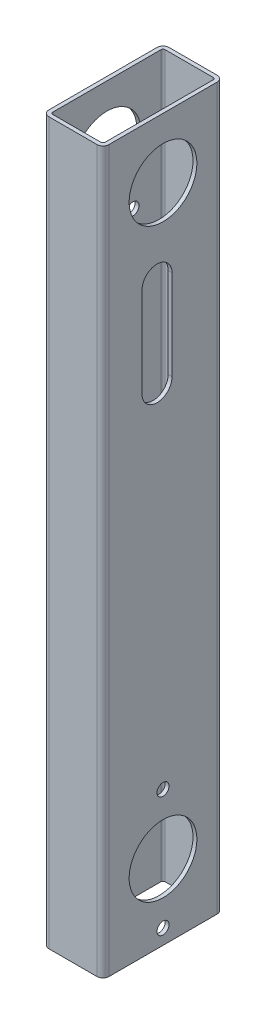
from build123d import *

# Parameters (mm, degrees)
EXTRUDE_THIN1_DEPTH      = 222.25
EXTRUDE_THIN1_DEPTH_BACK = 82.55
CUT_EXTRUDE1_REACH       = 227.134
CUT_EXTRUDE4_REACH       = 227.134
SKETCH4_R                = 2.5527
CUT_EXTRUDE3_DEPTH       = 1.651
SKETCH6_R                = 14.3256
CUT_EXTRUDE5_DEPTH       = 226.134143346
F_10_CLEARANCE_HOLE1_D   = 5.1054


with BuildPart() as part:
    # Sketch1 → Extrude-Thin1 (new, two sides: drawn at the far end of the back side and taken through both)
    with BuildSketch(Plane(origin=(0, 0, 0), x_dir=(1, 0, 0), z_dir=(0, 1, 0)).offset(-EXTRUDE_THIN1_DEPTH_BACK)):
        with BuildLine():
            Line((-10.16, 25.4), (10.16, 25.4))
            ThreePointArc((10.16, 25.4), (11.956051224, 24.656051224), (12.7, 22.86))
            Line((12.7, 22.86), (12.7, -22.86))
            ThreePointArc((12.7, -22.86), (11.956051224, -24.656051224), (10.16, -25.4))
            Line((10.16, -25.4), (-10.16, -25.4))
            ThreePointArc((-10.16, -25.4), (-11.956051224, -24.656051224), (-12.7, -22.86))
            Line((-12.7, -22.86), (-12.7, 22.86))
            ThreePointArc((-12.7, 22.86), (-11.956051224, 24.656051224), (-10.16, 25.4))
        make_face()
        with BuildLine():
            Line((-10.16, 23.749), (10.16, 23.749))
            ThreePointArc((10.16, 23.749), (10.788617928, 23.488617928), (11.049, 22.86))
            Line((11.049, 22.86), (11.049, -22.86))
            ThreePointArc((11.049, -22.86), (10.788617928, -23.488617928), (10.16, -23.749))
            Line((10.16, -23.749), (-10.16, -23.749))
            ThreePointArc((-10.16, -23.749), (-10.788617928, -23.488617928), (-11.049, -22.86))
            Line((-11.049, -22.86), (-11.049, 22.86))
            ThreePointArc((-11.049, 22.86), (-10.788617928, 23.488617928), (-10.16, 23.749))
        make_face(mode=Mode.SUBTRACT)
    extrude(amount=EXTRUDE_THIN1_DEPTH + EXTRUDE_THIN1_DEPTH_BACK)

    # Sketch2 → Cut-Extrude1 (cut, up to next)
    with BuildSketch(Plane.ZY.offset(12.7), mode=Mode.PRIVATE) as cut_extrude1_sk1:
        with BuildLine():
            Line((9.2075, 161.942613489), (9.2075, 12.7))
            ThreePointArc((9.2075, 12.7), (2.54, 6.0325), (-4.1275, 12.7))
            Line((-4.1275, 12.7), (-4.1275, 161.942613489))
            ThreePointArc((-4.1275, 161.942613489), (2.54, 168.610113489), (9.2075, 161.942613489))
        make_face()
    cut_extrude1_tool1 = extrude(cut_extrude1_sk1.sketch, amount=-CUT_EXTRUDE1_REACH, mode=Mode.PRIVATE) & part.part
    add(cut_extrude1_tool1.solids().sort_by_distance((-12.7, 87.321307, 2.54))[0], mode=Mode.SUBTRACT)

    # Sketch5 → Cut-Extrude4 (cut, up to next)
    with BuildSketch(Plane(origin=(12.7, 0, 0), x_dir=(0, 0, -1), z_dir=(1, 0, 0)), mode=Mode.PRIVATE) as cut_extrude4_sk1:
        with BuildLine():
            Line((3.81, 161.942613489), (3.81, 123.842613489))
            ThreePointArc((3.81, 123.842613489), (-2.54, 117.492613489), (-8.89, 123.842613489))
            Line((-8.89, 123.842613489), (-8.89, 161.942613489))
            ThreePointArc((-8.89, 161.942613489), (-2.54, 168.292613489), (3.81, 161.942613489))
        make_face()
    cut_extrude4_tool1 = extrude(cut_extrude4_sk1.sketch, amount=-CUT_EXTRUDE4_REACH, mode=Mode.PRIVATE) & part.part
    add(cut_extrude4_tool1.solids().sort_by_distance((12.7, 142.892613, 2.54))[0], mode=Mode.SUBTRACT)

    # Sketch4 → Cut-Extrude3 (cut)
    with BuildSketch(Plane(origin=(-12.7, 0, 0), x_dir=(0, 0, -1), z_dir=(1, 0, 0))):
        with Locations(Location((11.049, 4.771306688, 0), (0, 0, 180))):
            Circle(SKETCH4_R)
        with Locations(Location((-16.129, 4.771306688, 0), (0, 0, 180))):
            Circle(SKETCH4_R)
        with Locations(Location((-16.129, 87.321306688, 0), (0, 0, 180))):
            Circle(SKETCH4_R)
        with Locations(Location((11.049, 87.321306688, 0), (0, 0, 180))):
            Circle(SKETCH4_R)
        with Locations(Location((-16.129, 169.871306688, 0), (0, 0, 180))):
            Circle(SKETCH4_R)
        with Locations(Location((11.049, 169.871306688, 0), (0, 0, 180))):
            Circle(SKETCH4_R)
    extrude(amount=CUT_EXTRUDE3_DEPTH, mode=Mode.SUBTRACT)

    # Sketch6 → Cut-Extrude5 (cut, through all)
    with BuildSketch(Plane(origin=(12.7, 0, 0), x_dir=(0, 0, -1), z_dir=(1, 0, 0))):
        with Locations((0, -50.8)):
            Circle(SKETCH6_R)
        with Locations((0, 196.85)):
            Circle(SKETCH6_R)
    extrude(amount=-CUT_EXTRUDE5_DEPTH, mode=Mode.SUBTRACT)

    # #10 Clearance Hole1 (through all)
    with Locations(Plane(origin=(12.7, 0, 0), x_dir=(0, 0, -1), z_dir=(1, 0, 0))):
        with Locations((0, -25.4), (0, -76.2)):
            Hole(F_10_CLEARANCE_HOLE1_D / 2)


solid = part.part
